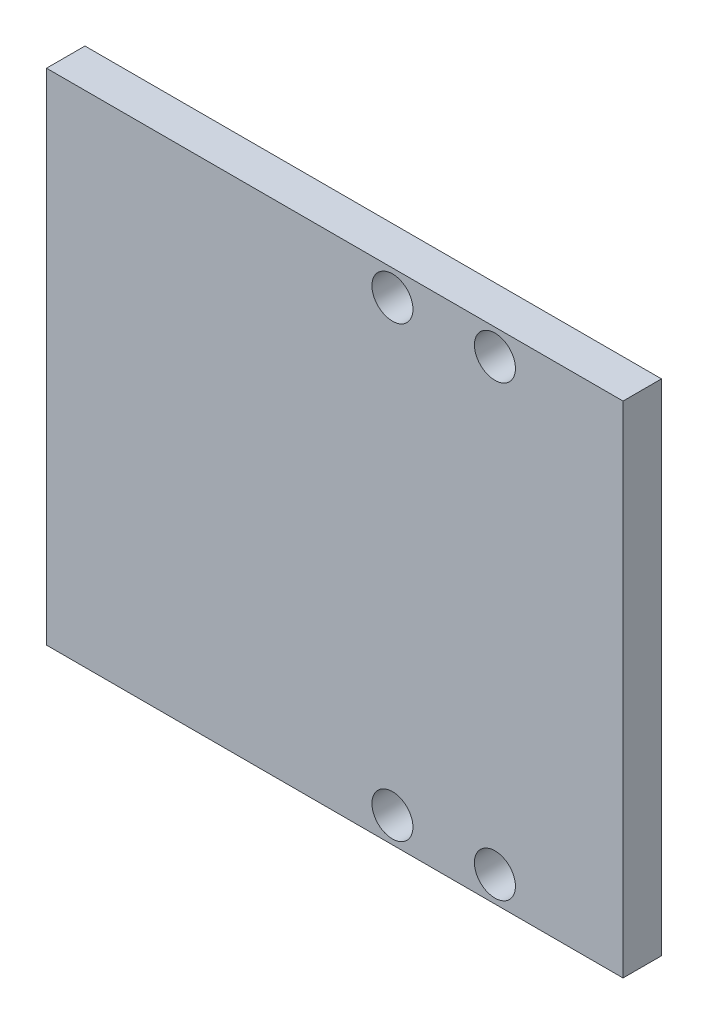
from build123d import *

# Parameters (mm, degrees)
SKETCH1_W           = 45
SKETCH1_H           = 38.999936721
SKETCH1_R           = 1.6
BOSS_EXTRUDE1_DEPTH = 3


with BuildPart() as part:
    # Sketch1 → Boss-Extrude1 (new body)
    with BuildSketch(Plane.XY):
        with Locations((47.5, 1.262499999)):
            Rectangle(SKETCH1_W, SKETCH1_H)
        with Locations((60, 18.76246836)):
            Circle(SKETCH1_R, mode=Mode.SUBTRACT)
        with Locations((52, 18.76246836)):
            Circle(SKETCH1_R, mode=Mode.SUBTRACT)
        with Locations((60, -16.237468361)):
            Circle(SKETCH1_R, mode=Mode.SUBTRACT)
        with Locations((52, -16.237468361)):
            Circle(SKETCH1_R, mode=Mode.SUBTRACT)
    extrude(amount=BOSS_EXTRUDE1_DEPTH)


solid = part.part
